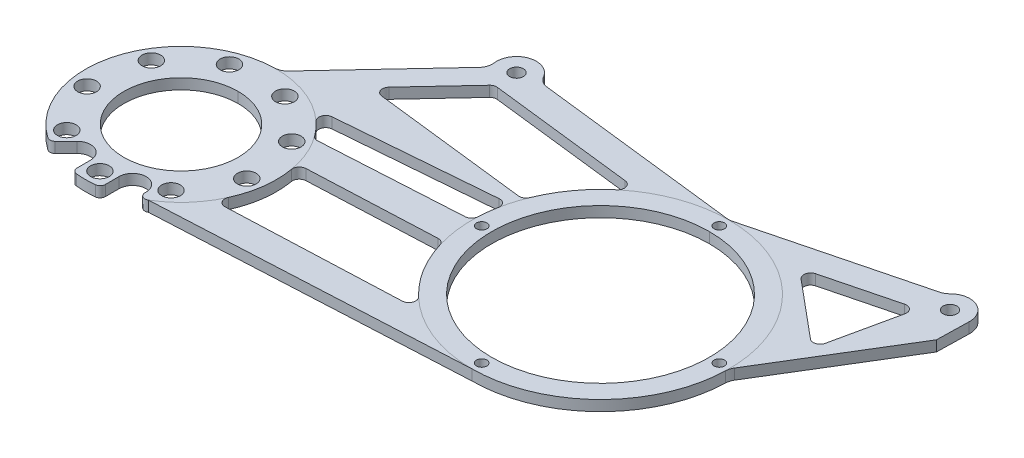
from build123d import *

# Parameters (mm, degrees)
SKETCH3_R           = 2.5
SKETCH3_R_2         = 52.3875
SKETCH3_R_3         = 3.3
SKETCH3_R_4         = 4.5
SKETCH3_R_5         = 27.4955
SKETCH3_R_6         = 3.300000004
BOSS_EXTRUDE1_DEPTH = 5.08
CUT_EXTRUDE1_REACH  = 321.397
CUT_EXTRUDE2_REACH  = 321.397
CUT_EXTRUDE4_REACH  = 321.397
CUT_EXTRUDE5_REACH  = 321.397
CUT_EXTRUDE6_REACH  = 321.397
FILLET1_R           = 6.604


with BuildPart() as part:
    # Sketch3 → Boss-Extrude1 (new body)
    with BuildSketch(Plane(origin=(0, 0, 0), x_dir=(-1, 0, 0), z_dir=(0, 1, 0))):
        with BuildLine():
            Line((-47.164225852, 28.786858925), (1.714987837, 81.055723289))
            ThreePointArc((1.714987837, 81.055723289), (46.941307752, 112.338258021), (29.825562347, 164.597881552))
            ThreePointArc((29.825562347, 164.597881552), (28.145398332, 165.051242365), (26.567761736, 164.316701751))
            Line((26.567761736, 164.316701751), (21.302878118, 159.051818133))
            ThreePointArc((21.302878118, 159.051818133), (14.21924173, 157.642795249), (10.20668404, 163.648012211))
            Line((10.20668404, 163.648012211), (10.20668404, 170.220745001))
            ThreePointArc((10.20668404, 170.220745001), (9.549518747, 171.925600851), (7.91807501, 172.748273949))
            ThreePointArc((7.91807501, 172.748273949), (3.367898451, 172.974), (-1.182278109, 172.748273949))
            ThreePointArc((-1.182278109, 172.748273949), (-2.813721846, 171.925600851), (-3.470887139, 170.220745001))
            Line((-3.470887139, 170.220745001), (-3.470887139, 163.648012211))
            ThreePointArc((-3.470887139, 163.648012211), (-9.970887139, 157.148012211), (-16.470887139, 163.648012211))
            Line((-16.470887139, 163.648012211), (-16.470887139, 164.225022653))
            ThreePointArc((-16.470887139, 164.225022653), (-17.760387302, 166.435870942), (-20.319588051, 166.401924563))
            Line((-20.319588051, 166.401924563), (-168.403592651, 158.863977372))
            Line((-168.403592651, 158.863977372), (-265.178957518, 163.648012211))
            Line((-265.178957518, 163.648012211), (-268.446360693, 19.778758396))
            ThreePointArc((-268.446360693, 19.778758396), (-262.000922025, 10.329558641), (-251.128758127, 13.883022842))
            Line((-251.128758127, 13.883022842), (-65.147106167, 22.945506915))
            ThreePointArc((-65.147106167, 22.945506915), (-52.854167936, 15.702363891), (-47.164225852, 28.786858925))
        make_face()
        with Locations(Location((-168.403592651, 39.801477371, 0), (0, 0, 90))):
            Circle(SKETCH3_R, mode=Mode.SUBTRACT)
        with Locations(Location((-225.553592651, 96.951477371, 0), (0, 0, 90))):
            Circle(SKETCH3_R, mode=Mode.SUBTRACT)
        with Locations(Location((-168.403592651, 96.951477372, 0), (0, 0, 90))):
            Circle(SKETCH3_R_2, mode=Mode.SUBTRACT)
        with Locations(Location((-111.253592651, 96.951477371, 0), (0, 0, 90))):
            Circle(SKETCH3_R, mode=Mode.SUBTRACT)
        with Locations(Location((-168.403592651, 154.101477371, 0), (0, 0, 90))):
            Circle(SKETCH3_R, mode=Mode.SUBTRACT)
        with Locations(Location((-55.796807523, 24.761419982, 0), (0, 0, 90))):
            Circle(SKETCH3_R_3, mode=Mode.SUBTRACT)
        with Locations(Location((28.436615228, 156.875733282, 0), (0, 0, 90))):
            Circle(SKETCH3_R_4, mode=Mode.SUBTRACT)
        with Locations(Location((-9.970887139, 90.351987789, 0), (0, 0, 90))):
            Circle(SKETCH3_R_4, mode=Mode.SUBTRACT)
        with Locations(Location((16.70668404, 90.351987789, 0), (0, 0, 90))):
            Circle(SKETCH3_R_4, mode=Mode.SUBTRACT)
        with Locations(Location((-30.407092297, 107.5, 0), (0, 0, 90))):
            Circle(SKETCH3_R_4, mode=Mode.SUBTRACT)
        with Locations(Location((37.142889198, 107.5, 0), (0, 0, 90))):
            Circle(SKETCH3_R_4, mode=Mode.SUBTRACT)
        with Locations(Location((3.367898451, 127, 0), (0, 0, 90))):
            Circle(SKETCH3_R_5, mode=Mode.SUBTRACT)
        with Locations(Location((-35.039603917, 133.772278929, 0), (0, 0, 90))):
            Circle(SKETCH3_R_4, mode=Mode.SUBTRACT)
        with Locations(Location((41.775400818, 133.772278929, 0), (0, 0, 90))):
            Circle(SKETCH3_R_4, mode=Mode.SUBTRACT)
        with Locations(Location((-21.700818327, 156.875733282, 0), (0, 0, 90))):
            Circle(SKETCH3_R_4, mode=Mode.SUBTRACT)
        with Locations(Location((3.367898451, 166, 0), (0, 0, 90))):
            Circle(SKETCH3_R_4, mode=Mode.SUBTRACT)
        with Locations(Location((-258.931181349, 19.346338398, 0), (0, 0, 90))):
            Circle(SKETCH3_R_6, mode=Mode.SUBTRACT)
    extrude(amount=BOSS_EXTRUDE1_DEPTH)

    # Sketch9 → Cut-Extrude1 (cut, up to next)
    with BuildSketch(Plane(origin=(0, 5.08, 0), x_dir=(1, 0, 0), z_dir=(0, 1, 0)), mode=Mode.PRIVATE) as cut_extrude1_sk1:
        with BuildLine():
            Line((230.316092651, -96.951477372), (268.099780231, -35.039278689))
            Line((268.099780231, -35.039278689), (265.178957518, -163.648012211))
            Line((265.178957518, -163.648012211), (168.403592651, -158.863977372))
            ThreePointArc((168.403592651, -158.863977372), (212.182341242, -140.730225962), (230.316092651, -96.951477372))
        make_face()
    cut_extrude1_tool1 = extrude(cut_extrude1_sk1.sketch, amount=-CUT_EXTRUDE1_REACH, mode=Mode.PRIVATE) & part.part
    # Sketch9 → Cut-Extrude1 (cut, up to next)
    with BuildSketch(Plane(origin=(0, 5.08, 0), x_dir=(1, 0, 0), z_dir=(0, 1, 0)), mode=Mode.PRIVATE) as cut_extrude1_sk2:
        Polygon((251.128758127, -13.883022842), (168.403592651, -35.038977372), (65.147106167, -22.945506915), align=None)
    cut_extrude1_tool2 = extrude(cut_extrude1_sk2.sketch, amount=-CUT_EXTRUDE1_REACH, mode=Mode.PRIVATE) & part.part
    add(cut_extrude1_tool1.solids().sort_by_distance((243.183286, 5.08, 119.496807))[0], mode=Mode.SUBTRACT)
    add(cut_extrude1_tool2.solids().sort_by_distance((161.559819, 5.08, 23.955836))[0], mode=Mode.SUBTRACT)

    # Sketch10 → Cut-Extrude2 (cut, up to next)
    with BuildSketch(Plane(origin=(0, 5.08, 0), x_dir=(1, 0, 0), z_dir=(0, 1, 0)), mode=Mode.PRIVATE) as cut_extrude2_sk1:
        with BuildLine():
            Line((126.96440839, -43.634475041), (57.261500394, -35.47082269))
            ThreePointArc((57.261500394, -35.47082269), (55.779720918, -35.645410279), (54.535819255, -36.469339824))
            Line((54.535819255, -36.469339824), (31.105609691, -61.52437556))
            ThreePointArc((31.105609691, -61.52437556), (30.434157188, -64.830429418), (33.082361116, -66.920371173))
            Line((33.082361116, -66.920371173), (107.615117732, -75.649698704))
            ThreePointArc((107.615117732, -75.649698704), (109.679489327, -75.212634657), (111.057673768, -73.614741447))
            ThreePointArc((111.057673768, -73.614741447), (118.395945624, -60.449519959), (128.697936364, -49.447598425))
            ThreePointArc((128.697936364, -49.447598425), (129.74459894, -45.970434966), (126.96440839, -43.634475041))
        make_face()
    cut_extrude2_tool1 = extrude(cut_extrude2_sk1.sketch, amount=-CUT_EXTRUDE2_REACH, mode=Mode.PRIVATE) & part.part
    add(cut_extrude2_tool1.solids().sort_by_distance((80.43858, 5.08, 55.50935))[0], mode=Mode.SUBTRACT)

    # Sketch12 → Cut-Extrude4 (cut, up to next)
    with BuildSketch(Plane(origin=(0, 5.08, 0), x_dir=(1, 0, 0), z_dir=(0, 1, 0)), mode=Mode.PRIVATE) as cut_extrude4_sk1:
        with BuildLine():
            Line((249.691658934, -31.738357521), (242.839914491, -63.203787175))
            ThreePointArc((242.839914491, -63.203787175), (240.68572501, -65.624297911), (237.499041194, -65.037398593))
            Line((237.499041194, -65.037398593), (210.225893969, -42.298994776))
            ThreePointArc((210.225893969, -42.298994776), (209.119626938, -39.034817578), (211.522257638, -36.56377625))
            Line((211.522257638, -36.56377625), (245.647149306, -27.836750413))
            ThreePointArc((245.647149306, -27.836750413), (248.757771926, -28.659322972), (249.691658934, -31.738357521))
        make_face()
    cut_extrude4_tool1 = extrude(cut_extrude4_sk1.sketch, amount=-CUT_EXTRUDE4_REACH, mode=Mode.PRIVATE) & part.part
    add(cut_extrude4_tool1.solids().sort_by_distance((232.663577, 5.08, 44.411136))[0], mode=Mode.SUBTRACT)

    # Sketch13 → Cut-Extrude5 (cut, up to next)
    with BuildSketch(Plane(origin=(0, 5.08, 0), x_dir=(1, 0, 0), z_dir=(0, 1, 0)), mode=Mode.PRIVATE) as cut_extrude5_sk1:
        with BuildLine():
            Line((103.453694718, -97.126401755), (36.43287071, -100.986145044))
            ThreePointArc((36.43287071, -100.986145044), (34.842208875, -100.679745253), (33.588682349, -99.653705706))
            ThreePointArc((33.588682349, -99.653705706), (30.860299189, -96.307343511), (27.830020313, -93.231693249))
            ThreePointArc((27.830020313, -93.231693249), (26.949082998, -89.730069681), (29.800859551, -87.515393937))
            Line((29.800859551, -87.515393937), (104.077509501, -81.423867894))
            ThreePointArc((104.077509501, -81.423867894), (106.803706724, -82.508060349), (107.590756045, -85.334396836))
            ThreePointArc((107.590756045, -85.334396836), (106.923967125, -89.643036953), (106.562061414, -93.987920308))
            ThreePointArc((106.562061414, -93.987920308), (105.609941649, -96.153447619), (103.453694718, -97.126401755))
        make_face()
    cut_extrude5_tool1 = extrude(cut_extrude5_sk1.sketch, amount=-CUT_EXTRUDE5_REACH, mode=Mode.PRIVATE) & part.part
    add(cut_extrude5_tool1.solids().sort_by_distance((69.06396, 5.08, 91.55919))[0], mode=Mode.SUBTRACT)

    # Sketch11 → Cut-Extrude6 (cut, up to next)
    with BuildSketch(Plane(origin=(0, 5.08, 0), x_dir=(1, 0, 0), z_dir=(0, 1, 0)), mode=Mode.PRIVATE) as cut_extrude6_sk1:
        with BuildLine():
            ThreePointArc((109.17784979, -114.992237854), (107.925725235, -113.25846106), (105.873806466, -112.655611792))
            Line((105.873806466, -112.655611792), (45.047435633, -115.33547257))
            ThreePointArc((45.047435633, -115.33547257), (42.621254202, -116.562921091), (41.938707081, -119.194862511))
            ThreePointArc((41.938707081, -119.194862511), (42.605357512, -126.738442657), (42.024583396, -134.289119823))
            ThreePointArc((42.024583396, -134.289119823), (40.637406634, -140.309462815), (38.45555618, -146.089455697))
            ThreePointArc((38.45555618, -146.089455697), (38.718980125, -149.302538125), (41.594710316, -150.759750098))
            Line((41.594710316, -150.759750098), (123.487203332, -147.402375423))
            ThreePointArc((123.487203332, -147.402375423), (126.441313333, -145.268908214), (125.633039875, -141.715720596))
            ThreePointArc((125.633039875, -141.715720596), (115.684078111, -129.413924027), (109.17784979, -114.992237854))
        make_face()
    cut_extrude6_tool1 = extrude(cut_extrude6_sk1.sketch, amount=-CUT_EXTRUDE6_REACH, mode=Mode.PRIVATE) & part.part
    add(cut_extrude6_tool1.solids().sort_by_distance((79.387948, 5.08, 132.50433))[0], mode=Mode.SUBTRACT)

    # Fillet1
    fillet1_edges = [part.edges().sort_by_distance(p)[0] for p in [
        (230.316092651, 2.54, 96.951477372),
        (168.403592651, 2.54, 35.038977372),
        (-1.714987837, 2.54, 81.055723289),
        (47.164225852, 2.54, 28.786858925),
        (65.147106167, 2.54, 22.945506915),
        (251.128758127, 2.54, 13.883022842),
    ]]
    fillet(fillet1_edges, radius=FILLET1_R)


solid = part.part
